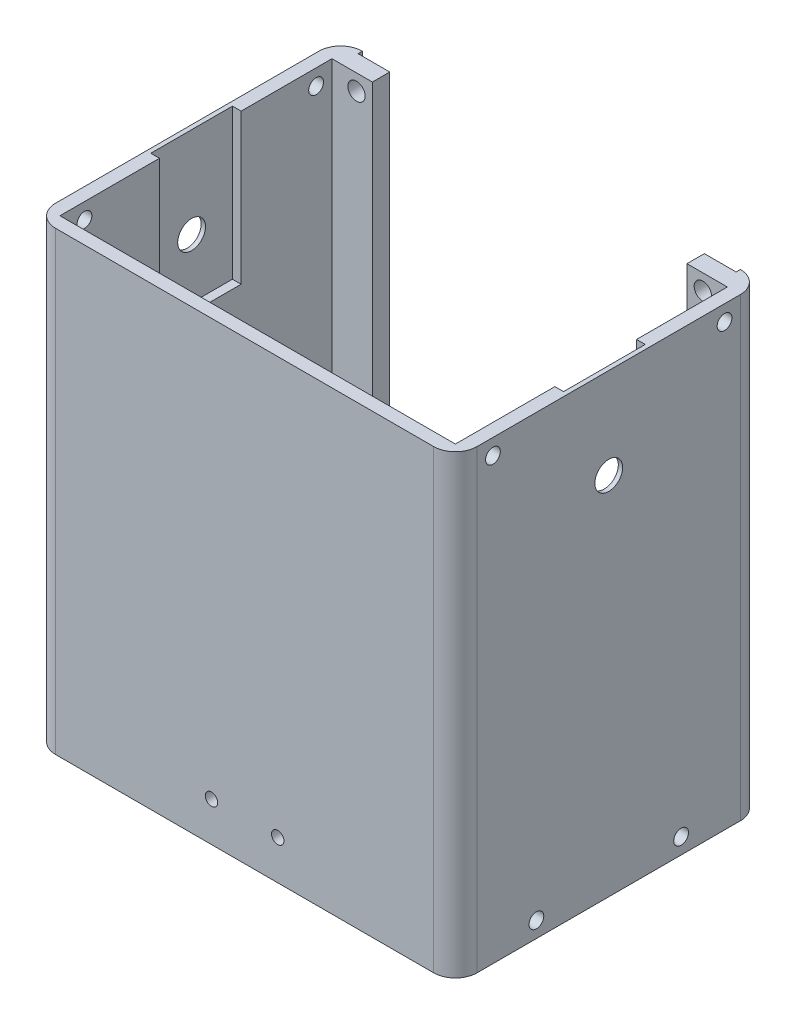
from build123d import *

# Parameters (mm, degrees)
BOSS_EXTRUDE1_DEPTH     = 104.887
SKETCH2_R               = 1.7
CUT_EXTRUDE1_DEPTH      = 148.161043653
SKETCH6_R               = 1.7
CUT_EXTRUDE9_DEPTH      = 148.161043653
SKETCH3_9_R             = 3.2
CUT_EXTRUDE4_DEPTH      = 148.161043653
SKETCH4_R               = 2
CUT_EXTRUDE5_DEPTH      = 4
SKETCH5_R               = 1.43
CUT_EXTRUDE6_DEPTH      = 136.417475863
MIRROR9_COPY_1_SKETCH_R = 2
MIRROR9_COPY_1_DEPTH    = 4
CUT_EXTRUDE7_START      = -1
SKETCH3_10_W            = 10.4
SKETCH3_10_H            = 14.6
SKETCH3_10_H_2          = 12.6
SKETCH3_10_R            = 3.2
SKETCH3_10_R_2          = 1
CUT_EXTRUDE7_DEPTH      = 2
CUT_EXTRUDE8_START      = -94
SKETCH3_W               = 10.4
SKETCH3_H               = 14.6
SKETCH3_H_2             = 12.6
SKETCH3_R               = 3.2
SKETCH3_R_2             = 1
CUT_EXTRUDE8_DEPTH      = 2


with BuildPart() as part:
    # Sketch1 → Boss-Extrude1 (new body)
    with BuildSketch(Plane(origin=(0, 0, 0), x_dir=(1, 0, 0), z_dir=(0, 1, 0))):
        with BuildLine():
            ThreePointArc((-48.5, -30.3), (-47.035533906, -33.835533906), (-43.5, -35.3))
            Line((-43.5, -35.3), (43.5, -35.3))
            ThreePointArc((43.5, -35.3), (47.035533906, -33.835533906), (48.5, -30.3))
            Line((48.5, -30.3), (48.5, 30.3))
            ThreePointArc((48.5, 30.3), (47.035533906, 33.835533906), (43.5, 35.3))
            Line((43.5, 35.3), (43.5, 34.3))
            Line((43.5, 34.3), (36.2, 34.3))
            Line((36.2, 34.3), (36.2, 30.3))
            Line((36.2, 30.3), (45.5, 30.3))
            Line((45.5, 30.3), (45.5, -32.3))
            Line((45.5, -32.3), (-45.5, -32.3))
            Line((-45.5, -32.3), (-45.5, 30.3))
            Line((-45.5, 30.3), (-36.2, 30.3))
            Line((-36.2, 30.3), (-36.2, 34.3))
            Line((-36.2, 34.3), (-43.5, 34.3))
            Line((-43.5, 34.3), (-43.5, 35.3))
            ThreePointArc((-43.5, 35.3), (-47.035533906, 33.835533906), (-48.5, 30.3))
            Line((-48.5, 30.3), (-48.5, -30.3))
        make_face()
    extrude(amount=BOSS_EXTRUDE1_DEPTH)

    # Sketch2 → Cut-Extrude1 (cut, through all)
    with BuildSketch(Plane(origin=(48.5, 0, 0), x_dir=(0, 0, -1), z_dir=(1, 0, 0))):
        with Locations((16.65, 3.65)):
            Circle(SKETCH2_R)
        with Locations((-16.65, 3.65)):
            Circle(SKETCH2_R)
    extrude(amount=-CUT_EXTRUDE1_DEPTH, mode=Mode.SUBTRACT)

    # Sketch6 → Cut-Extrude9 (cut, through all)
    with BuildSketch(Plane(origin=(48.5, 0, 0), x_dir=(0, 0, -1), z_dir=(1, 0, 0))):
        with Locations((-26.65, 101.237)):
            Circle(SKETCH6_R)
    cut_extrude9 = extrude(amount=-CUT_EXTRUDE9_DEPTH, mode=Mode.SUBTRACT)

    # Mirror11: Cut-Extrude9 across plane
    add(cut_extrude9.mirror(Plane.XY), mode=Mode.SUBTRACT)

    # Sketch3<9> → Cut-Extrude4 (cut, through all)
    with BuildSketch(Plane.ZY.offset(48.5)):
        with Locations((0, 83.987)):
            Circle(SKETCH3_9_R)
    extrude(amount=-CUT_EXTRUDE4_DEPTH, mode=Mode.SUBTRACT)

    # Sketch4 → Cut-Extrude5 (cut)
    with BuildSketch(Plane(origin=(0, 0, -34.3), x_dir=(-1, 0, 0), z_dir=(0, 0, -1))):
        with Locations((39.85, 3.65)):
            Circle(SKETCH4_R)
    cut_extrude5 = extrude(amount=-CUT_EXTRUDE5_DEPTH, mode=Mode.SUBTRACT)

    # Mirror7: Cut-Extrude5 across plane
    add(cut_extrude5.mirror(Plane(origin=(0, 0, 0), x_dir=(0, 0, 1), z_dir=(1, 0, 0))), mode=Mode.SUBTRACT)

    # Sketch5 → Cut-Extrude6 (cut, through all)
    with BuildSketch(Plane.XY.offset(35.3)):
        with Locations((-7.625, 9.05)):
            Circle(SKETCH5_R)
        with Locations(Location((7.625, 9.05, 0), (0, 0, 180))):
            Circle(SKETCH5_R)
    extrude(amount=-CUT_EXTRUDE6_DEPTH, mode=Mode.SUBTRACT)

    # Mirror9: Cut-Extrude5 across plane
    add(cut_extrude5.mirror(Plane.ZX.offset(52.4435)), mode=Mode.SUBTRACT)

    # Mirror9 copy 1 sketch → Mirror9 copy 1 (cut)
    with BuildSketch(Plane(origin=(0, 104.887, -34.3), x_dir=(1, 0, 0), z_dir=(0, 0, -1))):
        with Locations((39.85, 3.65)):
            Circle(MIRROR9_COPY_1_SKETCH_R)
    extrude(amount=-MIRROR9_COPY_1_DEPTH, mode=Mode.SUBTRACT)

    # Sketch3<10> → Cut-Extrude7 (cut)
    # profile 1 of 8: a face of its own
    with BuildSketch(Plane.ZY.offset(48.5).offset(CUT_EXTRUDE7_START)):
        Polygon((-5.2, 77.687), (-5.2, 90.287), (-5.2, 104.887), (-9.4, 104.887), (-9.4, 77.687), align=None)
    # profile 2 of 8: a face of its own
    with BuildSketch(Plane.ZY.offset(48.5).offset(CUT_EXTRUDE7_START)):
        Polygon((5.2, 104.887), (5.2, 90.287), (5.2, 77.687), (9.4, 77.687), (9.4, 104.887), align=None)
    # profile 3 of 8: a face of its own
    with BuildSketch(Plane.ZY.offset(48.5).offset(CUT_EXTRUDE7_START)):
        with Locations((0, 97.587)):
            Rectangle(SKETCH3_10_W, SKETCH3_10_H)
    # profile 4 of 8: a face of its own
    with BuildSketch(Plane.ZY.offset(48.5).offset(CUT_EXTRUDE7_START)):
        Polygon((-9.4, 70.387), (9.4, 70.387), (9.4, 77.687), (5.2, 77.687), (-5.2, 77.687), (-9.4, 77.687), align=None)
    # profile 5 of 8: a face of its own
    with BuildSketch(Plane.ZY.offset(48.5).offset(CUT_EXTRUDE7_START)):
        with Locations((0, 83.987)):
            Rectangle(SKETCH3_10_W, SKETCH3_10_H_2)
        with Locations((0, 83.987)):
            Circle(SKETCH3_10_R, mode=Mode.SUBTRACT)
        with Locations((0, 79.487)):
            Circle(SKETCH3_10_R_2, mode=Mode.SUBTRACT)
        with Locations((0, 88.487)):
            Circle(SKETCH3_10_R_2, mode=Mode.SUBTRACT)
    # profile 6 of 8: a face of its own
    with BuildSketch(Plane.ZY.offset(48.5).offset(CUT_EXTRUDE7_START)):
        with Locations((0, 79.487)):
            Circle(SKETCH3_10_R_2)
    # profile 7 of 8: a face of its own
    with BuildSketch(Plane.ZY.offset(48.5).offset(CUT_EXTRUDE7_START)):
        with Locations((0, 83.987)):
            Circle(SKETCH3_10_R)
    # profile 8 of 8: a face of its own
    with BuildSketch(Plane.ZY.offset(48.5).offset(CUT_EXTRUDE7_START)):
        with Locations((0, 88.487)):
            Circle(SKETCH3_10_R_2)
    extrude(amount=-CUT_EXTRUDE7_DEPTH, mode=Mode.SUBTRACT)

    # Sketch3 → Cut-Extrude8 (cut)
    # profile 1 of 8: a face of its own
    with BuildSketch(Plane.ZY.offset(48.5).offset(CUT_EXTRUDE8_START)):
        Polygon((-5.2, 77.687), (-5.2, 90.287), (-5.2, 104.887), (-9.4, 104.887), (-9.4, 77.687), align=None)
    # profile 2 of 8: a face of its own
    with BuildSketch(Plane.ZY.offset(48.5).offset(CUT_EXTRUDE8_START)):
        Polygon((5.2, 104.887), (5.2, 90.287), (5.2, 77.687), (9.4, 77.687), (9.4, 104.887), align=None)
    # profile 3 of 8: a face of its own
    with BuildSketch(Plane.ZY.offset(48.5).offset(CUT_EXTRUDE8_START)):
        with Locations((0, 97.587)):
            Rectangle(SKETCH3_W, SKETCH3_H)
    # profile 4 of 8: a face of its own
    with BuildSketch(Plane.ZY.offset(48.5).offset(CUT_EXTRUDE8_START)):
        with Locations((0, 83.987)):
            Rectangle(SKETCH3_W, SKETCH3_H_2)
        with Locations((0, 83.987)):
            Circle(SKETCH3_R, mode=Mode.SUBTRACT)
        with Locations((0, 79.487)):
            Circle(SKETCH3_R_2, mode=Mode.SUBTRACT)
        with Locations((0, 88.487)):
            Circle(SKETCH3_R_2, mode=Mode.SUBTRACT)
    # profile 5 of 8: a face of its own
    with BuildSketch(Plane.ZY.offset(48.5).offset(CUT_EXTRUDE8_START)):
        with Locations((0, 88.487)):
            Circle(SKETCH3_R_2)
    # profile 6 of 8: a face of its own
    with BuildSketch(Plane.ZY.offset(48.5).offset(CUT_EXTRUDE8_START)):
        with Locations((0, 83.987)):
            Circle(SKETCH3_R)
    # profile 7 of 8: a face of its own
    with BuildSketch(Plane.ZY.offset(48.5).offset(CUT_EXTRUDE8_START)):
        with Locations((0, 79.487)):
            Circle(SKETCH3_R_2)
    # profile 8 of 8: a face of its own
    with BuildSketch(Plane.ZY.offset(48.5).offset(CUT_EXTRUDE8_START)):
        Polygon((-9.4, 70.387), (9.4, 70.387), (9.4, 77.687), (5.2, 77.687), (-5.2, 77.687), (-9.4, 77.687), align=None)
    extrude(amount=-CUT_EXTRUDE8_DEPTH, mode=Mode.SUBTRACT)


solid = part.part
